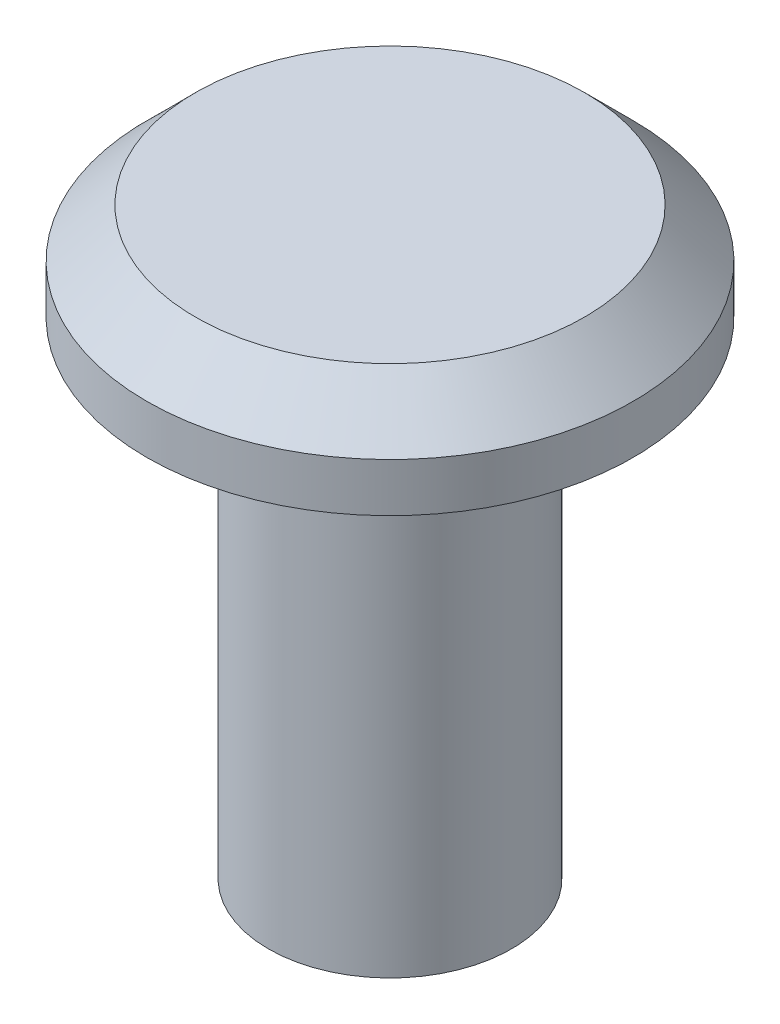
from build123d import *


with BuildPart() as part:
    # Esquisse1 → Révolution1 (revolve)
    with BuildSketch(Plane.XY, mode=Mode.PRIVATE) as r_volution1_sk:
        Polygon((0, 0), (0, 12), (-4, 12), (-5, 11), (-5, 10), (-2.5, 10), (-2.5, 0), align=None)
    revolve(r_volution1_sk.sketch.rotate(Axis((0, 0, 0), (0, 1, 0)), 270), axis=Axis((0, 0, 0), (0, 1, 0)))


solid = part.part
